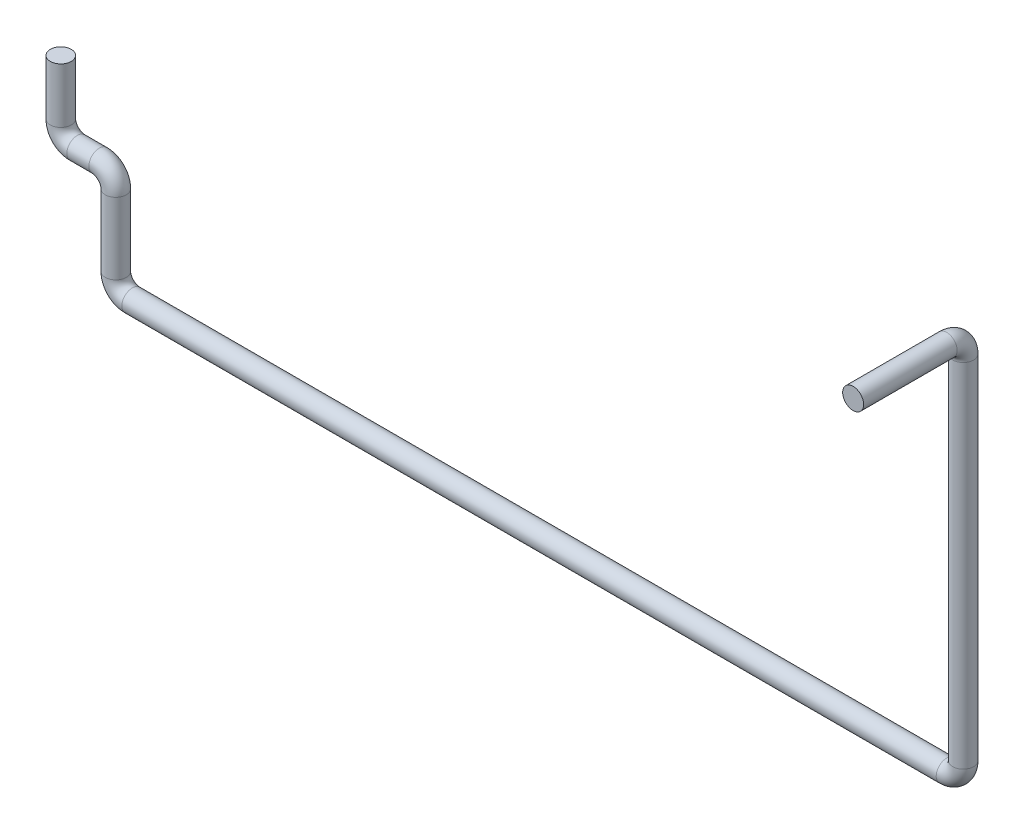
from build123d import *

# Parameters (mm, degrees)
CROQUIS1_R              = 9.525
SALIENTE_EXTRUIR1_DEPTH = 10
CROQUIS2_R              = 9.525


with BuildPart() as part:
    # Croquis1 → Saliente-Extruir1 (new body)
    with BuildSketch(Plane(origin=(0, 0, 0), x_dir=(1, 0, 0), z_dir=(0, 1, 0))):
        with Locations(Location((0, 0, 0), (0, 0, 270))):
            Circle(CROQUIS1_R)
    extrude(amount=-SALIENTE_EXTRUIR1_DEPTH)

    # Barrer1: sweep along a curve in space
    with BuildLine() as barrer1_path:
        Line((0, -10, 0), (0, -50, 0))
        ThreePointArc((0, -50, 0), (4.393398282, -60.606601718, 0), (15, -65, 0))
        Line((15, -65, 0), (35, -65, 0))
        ThreePointArc((35, -65, 0), (45.606601718, -69.393398282, 0), (50, -80, 0))
        Line((50, -80, 0), (50, -145, 0))
        ThreePointArc((50, -145, 0), (54.393398282, -155.606601718, 0), (65, -160, 0))
        Line((65, -160, 0), (805, -160, 0))
        ThreePointArc((805, -160, 0), (815.606601718, -155.606601718, 0), (820, -145, 0))
        Line((820, -145, 0), (820, 175, 0))
        ThreePointArc((820, 175, 0), (820, 185.606601718, 4.393398282), (820, 190, 15))
        Line((820, 190, 15), (820, 190, 100))
    # Croquis2 → Barrer1 (sweep)
    with BuildSketch(Plane.XZ.offset(10)):
        Circle(CROQUIS2_R)
    sweep(path=barrer1_path.line)


solid = part.part
